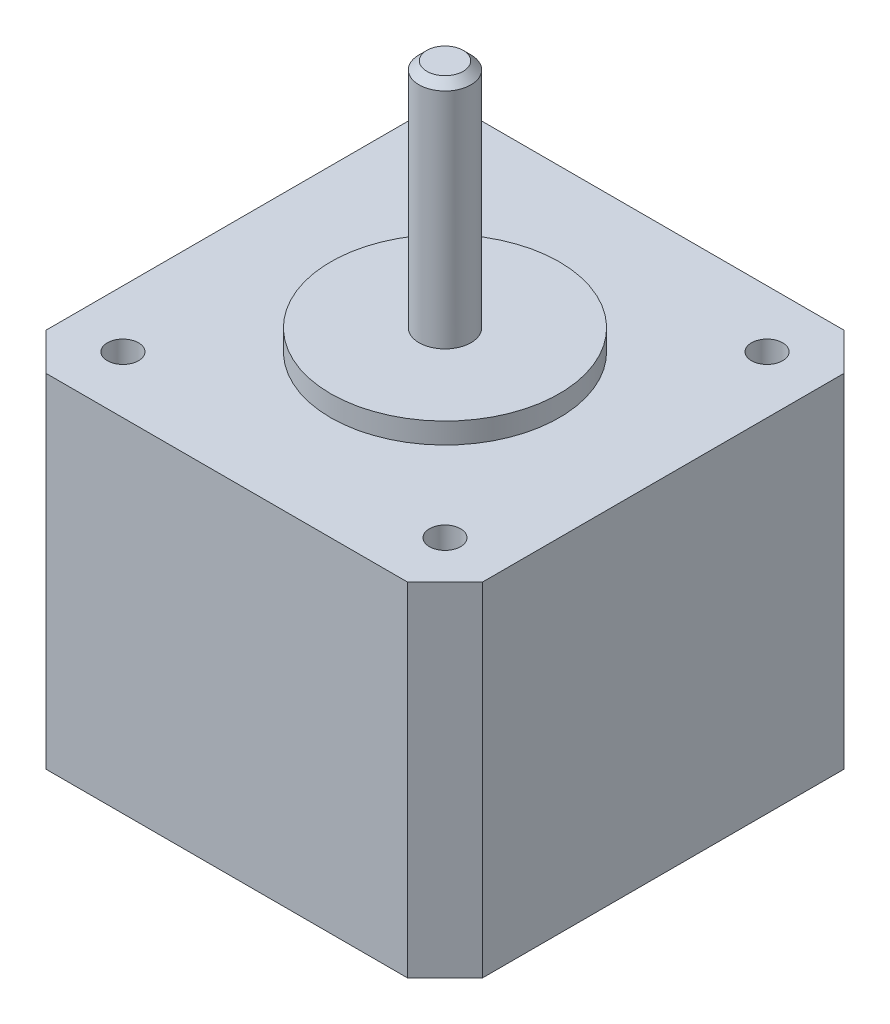
from build123d import *

# Parameters (mm, degrees)
SKETCH1_W           = 42
SKETCH1_H           = 42
BOSS_EXTRUDE1_DEPTH = 33
SKETCH2_R           = 11
BOSS_EXTRUDE2_DEPTH = 2
SKETCH3_R           = 2.5
BOSS_EXTRUDE3_DEPTH = 22.25
CHAMFER1_SIZE       = 3.6
SKETCH4_R           = 1.5
CUT_EXTRUDE1_DEPTH  = 5
CHAMFER2_SIZE       = 0.75


with BuildPart() as part:
    # Sketch1 → Boss-Extrude1 (new body)
    with BuildSketch(Plane(origin=(0, 0, 0), x_dir=(1, 0, 0), z_dir=(0, 1, 0))):
        Rectangle(SKETCH1_W, SKETCH1_H)
    extrude(amount=BOSS_EXTRUDE1_DEPTH)

    # Sketch2 → Boss-Extrude2 (add)
    with BuildSketch(Plane(origin=(0, 33, 0), x_dir=(1, 0, 0), z_dir=(0, 1, 0))):
        with Locations(Location((0, 0, 0), (0, 0, 270))):
            Circle(SKETCH2_R)
    extrude(amount=BOSS_EXTRUDE2_DEPTH)

    # Sketch3 → Boss-Extrude3 (add)
    with BuildSketch(Plane(origin=(0, 35, 0), x_dir=(1, 0, 0), z_dir=(0, 1, 0))):
        with Locations(Location((0, 0, 0), (0, 0, 270))):
            Circle(SKETCH3_R)
    extrude(amount=BOSS_EXTRUDE3_DEPTH)

    # Chamfer1
    chamfer1_edges = [part.edges().sort_by_distance(p)[0] for p in [
        (21, 16.5, 21),
        (-21, 16.5, 21),
        (-21, 16.5, -21),
        (21, 16.5, -21),
    ]]
    chamfer(chamfer1_edges, length=CHAMFER1_SIZE)

    # Sketch4 → Cut-Extrude1 (cut)
    with BuildSketch(Plane(origin=(0, 33, 0), x_dir=(1, 0, 0), z_dir=(0, 1, 0))):
        with Locations(Location((15.5, 15.5, 0), (0, 0, 270))):
            Circle(SKETCH4_R)
        with Locations(Location((15.5, -15.5, 0), (0, 0, 270))):
            Circle(SKETCH4_R)
        with Locations(Location((-15.5, -15.5, 0), (0, 0, 270))):
            Circle(SKETCH4_R)
        with Locations(Location((-15.5, 15.5, 0), (0, 0, 270))):
            Circle(SKETCH4_R)
    extrude(amount=-CUT_EXTRUDE1_DEPTH, mode=Mode.SUBTRACT)

    # Chamfer2
    chamfer2_edges = [part.edges().sort_by_distance(p)[0] for p in [
        (0, 57.25, -2.5),
    ]]
    chamfer(chamfer2_edges, length=CHAMFER2_SIZE)


solid = part.part
